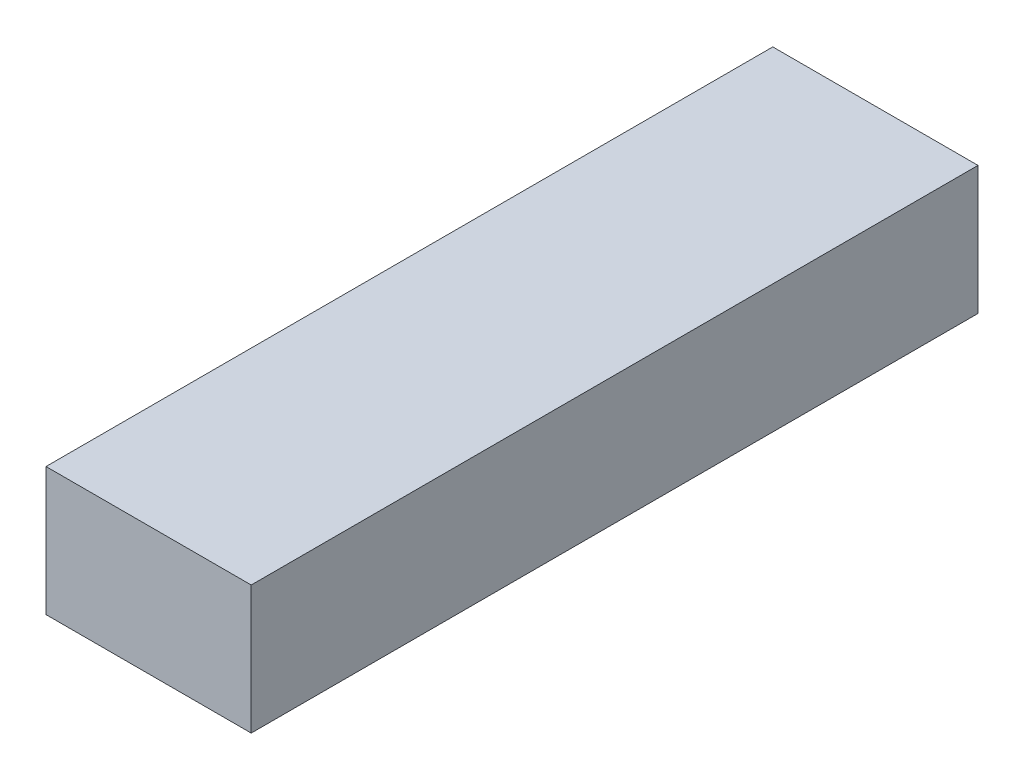
from build123d import *

# Parameters (mm, degrees)
SKETCH_1_W      = 48
SKETCH_1_H      = 30
EXTRUDE_1_DEPTH = 170


with BuildPart() as part:
    # 草图1 → 凸台-拉伸1 (new body)
    with BuildSketch(Plane.XY):
        Rectangle(SKETCH_1_W, SKETCH_1_H)
    extrude(amount=EXTRUDE_1_DEPTH)


solid = part.part
